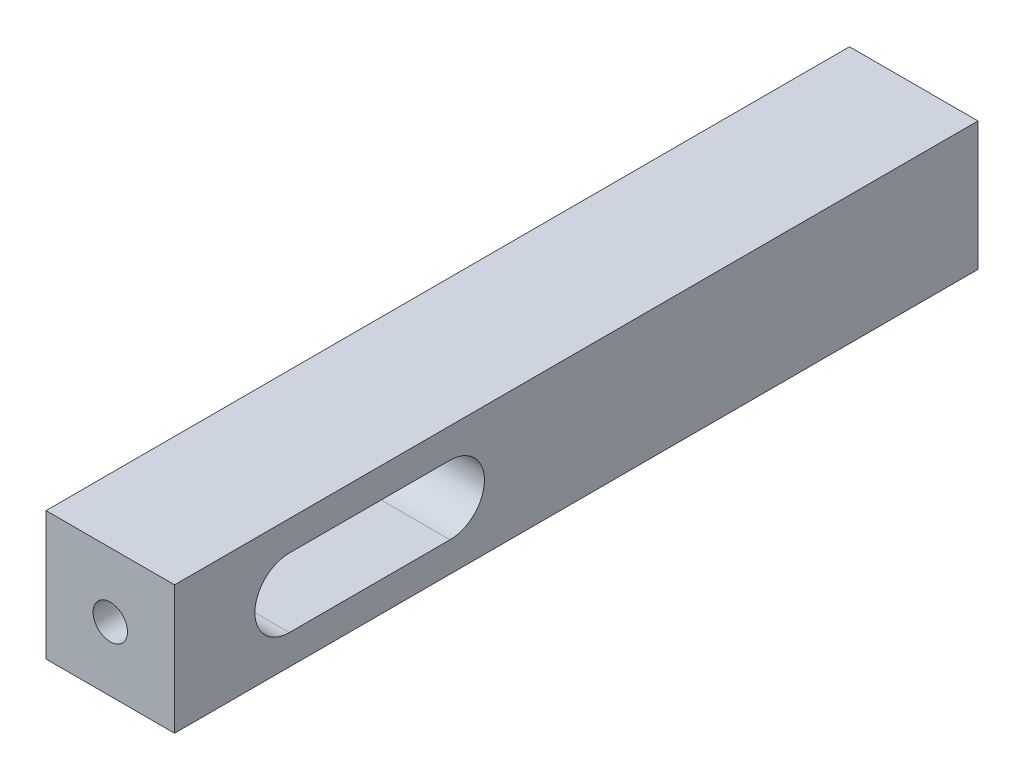
from build123d import *

# Parameters (mm, degrees)
SKETCH1_W           = 5.6
SKETCH1_H           = 5.6
SKETCH1_R           = 0.75
BOSS_EXTRUDE1_DEPTH = 35
CUT_EXTRUDE1_DEPTH  = 36.555590278


with BuildPart() as part:
    # Sketch1 → Boss-Extrude1 (new body)
    with BuildSketch(Plane.XY):
        Rectangle(SKETCH1_W, SKETCH1_H)
        Circle(SKETCH1_R, mode=Mode.SUBTRACT)
    extrude(amount=BOSS_EXTRUDE1_DEPTH)

    # Sketch2 → Cut-Extrude1 (cut, through all)
    with BuildSketch(Plane.ZY.offset(2.8)):
        with BuildLine():
            Line((23, 1.5), (30, 1.5))
            ThreePointArc((30, 1.5), (31.5, 0), (30, -1.5))
            Line((30, -1.5), (23, -1.5))
            ThreePointArc((23, -1.5), (21.5, 0), (23, 1.5))
        make_face()
    extrude(amount=-CUT_EXTRUDE1_DEPTH, mode=Mode.SUBTRACT)


solid = part.part
